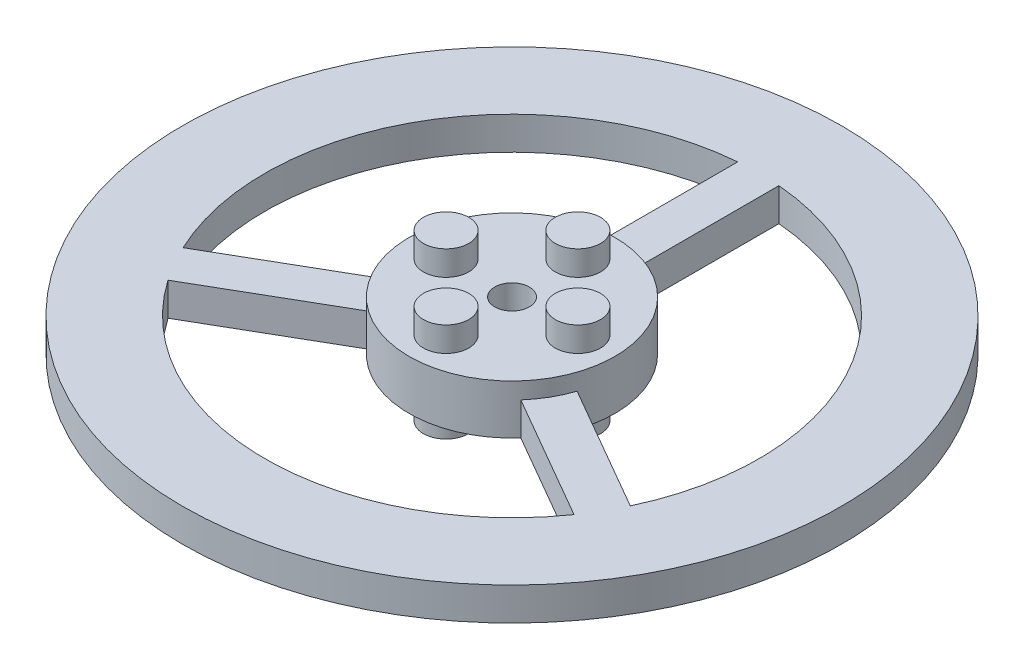
from build123d import *

# Parameters (mm, degrees)
ESBO_O1_R                     = 40
RESSALTO_EXTRUS_O1_DEPTH      = 4
ESBO_O2_R                     = 2.1
CORTE_EXTRUS_O1_DEPTH         = 4
ESBO_O3_R                     = 12.5
ESBO_O3_R_2                   = 2.1
RESSALTO_EXTRUS_O2_DEPTH      = 2
RESSALTO_EXTRUS_O3_DEPTH      = 3
RESSALTO_EXTRUS_O3_DEPTH_BACK = 9
ESBO_O4_R                     = 2.75


with BuildPart() as part:
    # Esboço1 → Ressalto-extrusão1 (new body)
    with BuildSketch(Plane(origin=(0, 0, 0), x_dir=(1, 0, 0), z_dir=(0, 1, 0))):
        Circle(ESBO_O1_R)
        with BuildLine():
            Line((-9.356601718, -8.288787866), (-24.640393972, -17.112889438))
            ThreePointArc((-24.640393972, -17.112889438), (0, -30), (24.640393972, -17.112889438))
            Line((24.640393972, -17.112889438), (9.356601718, -8.288787866))
            ThreePointArc((9.356601718, -8.288787866), (0, -12.5), (-9.356601718, -8.288787866))
        make_face(mode=Mode.SUBTRACT)
        with BuildLine():
            Line((-11.856601718, -3.958660847), (-27.140393972, -12.782762419))
            ThreePointArc((-27.140393972, -12.782762419), (-25.980762114, 15), (-2.5, 29.895651858))
            Line((-2.5, 29.895651858), (-2.5, 12.247448714))
            ThreePointArc((-2.5, 12.247448714), (-10.825317547, 6.25), (-11.856601718, -3.958660847))
        make_face(mode=Mode.SUBTRACT)
        with BuildLine():
            Line((2.5, 12.247448714), (2.5, 29.895651858))
            ThreePointArc((2.5, 29.895651858), (25.980762114, 15), (27.140393972, -12.782762419))
            Line((27.140393972, -12.782762419), (11.856601718, -3.958660847))
            ThreePointArc((11.856601718, -3.958660847), (10.825317547, 6.25), (2.5, 12.247448714))
        make_face(mode=Mode.SUBTRACT)
    extrude(amount=RESSALTO_EXTRUS_O1_DEPTH)

    # Esboço2 → Corte-extrusão1 (cut)
    with BuildSketch(Plane(origin=(0, 4, 0), x_dir=(1, 0, 0), z_dir=(0, 1, 0))):
        Circle(ESBO_O2_R)
    extrude(amount=-CORTE_EXTRUS_O1_DEPTH, mode=Mode.SUBTRACT)

    # Esboço3 → Ressalto-extrusão2 (add)
    with BuildSketch(Plane(origin=(0, 4, 0), x_dir=(1, 0, 0), z_dir=(0, 1, 0))):
        Circle(ESBO_O3_R)
        Circle(ESBO_O3_R_2, mode=Mode.SUBTRACT)
    extrude(amount=RESSALTO_EXTRUS_O2_DEPTH)

    # Esboço4 → Ressalto-extrusão3 (add, two sides: drawn at the far end of the back side and taken through both)
    with BuildSketch(Plane(origin=(0, 6, 0), x_dir=(1, 0, 0), z_dir=(0, 1, 0)).offset(-RESSALTO_EXTRUS_O3_DEPTH_BACK)):
        with Locations((0, 8)):
            Circle(ESBO_O4_R)
        with Locations((8, 0)):
            Circle(ESBO_O4_R)
        with Locations((0, -8)):
            Circle(ESBO_O4_R)
        with Locations((-8, 0)):
            Circle(ESBO_O4_R)
    extrude(amount=RESSALTO_EXTRUS_O3_DEPTH + RESSALTO_EXTRUS_O3_DEPTH_BACK)


solid = part.part
